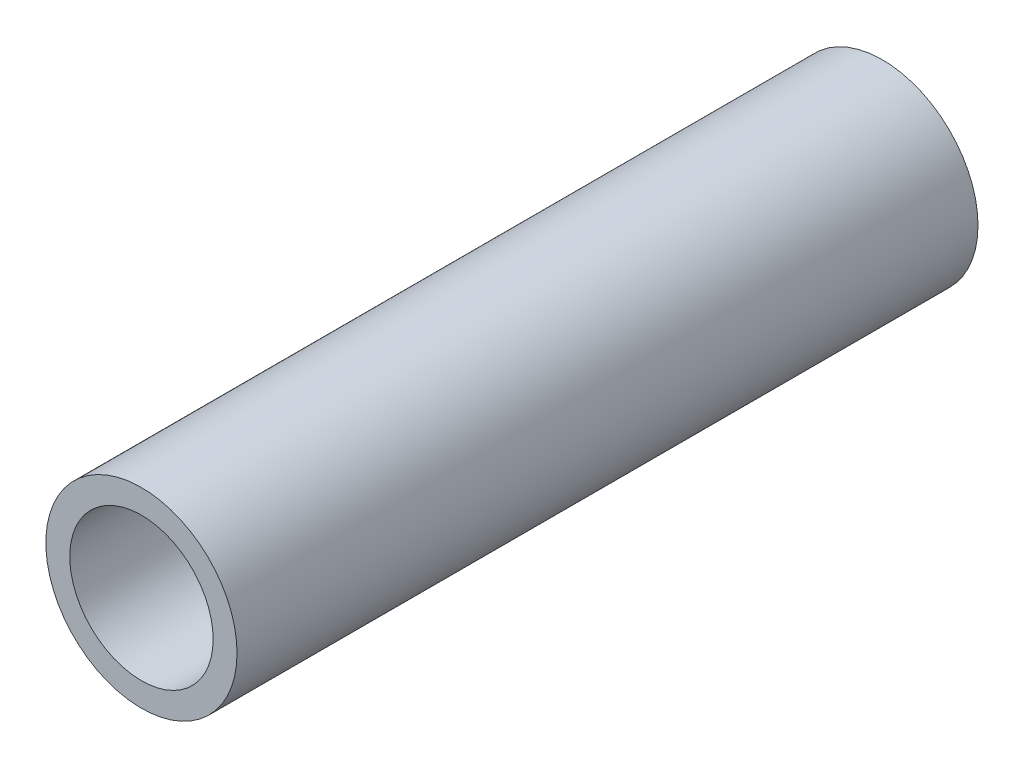
from build123d import *

# Parameters (mm, degrees)
SKETCH1_R           = 8
SKETCH1_R_2         = 6
BOSS_EXTRUDE1_DEPTH = 62


with BuildPart() as part:
    # Sketch1 → Boss-Extrude1 (new body)
    with BuildSketch(Plane.XY):
        Circle(SKETCH1_R)
        Circle(SKETCH1_R_2, mode=Mode.SUBTRACT)
    extrude(amount=BOSS_EXTRUDE1_DEPTH)


solid = part.part
